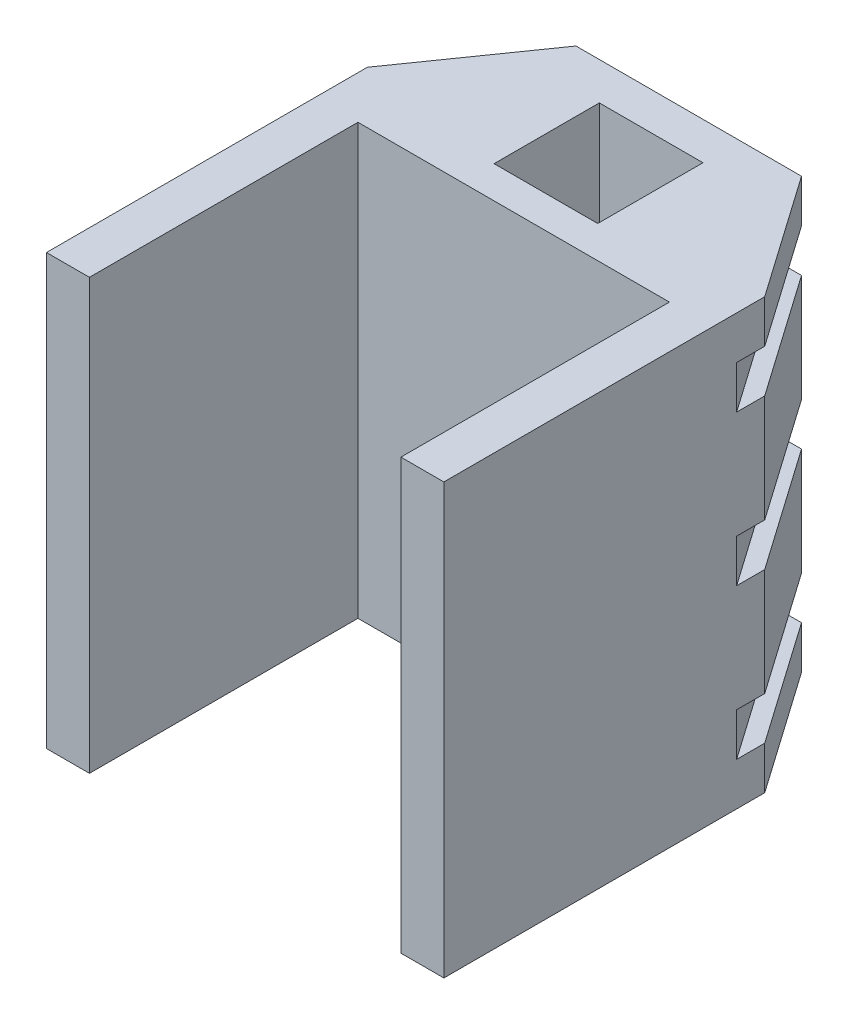
from build123d import *

# Parameters (mm, degrees)
SKETCH2_W              = 4
SKETCH2_H              = 40
SKETCH2_W_2            = 9.675
SKETCH2_W_3            = 9.65
BOTTOMBASE_DEPTH       = 3.5
EXTRUDE_START          = 3.5
SKETCH2_3_W            = 9.675
SKETCH2_3_H            = 40
SKETCH2_3_W_2          = 4
EXTRUDE_U_DEPTH        = 9.8
TOPFORU_START          = 13.3
SKETCH2_5_W            = 37
SKETCH2_5_H            = 40
TOPFORU_DEPTH          = 3
ANGLEDBOTTOM_SIZE      = 8
ANGLEDBOTTOM_SIZE2     = 11.425184054
SIDESTOHOLDMOTOR_START = 16.3
SKETCH2_4_W            = 4
SKETCH2_4_H            = 40
SIDESTOHOLDMOTOR_DEPTH = 25
SKETCH3_W              = 33.690968993
SKETCH3_H              = 4
ZIPTIEHOLE_DEPTH       = 1.5
SKETCH4_W              = 50.344511624
SKETCH4_H              = 4
ZIPTIEHOLE2_DEPTH      = 1.5


with BuildPart() as part:
    # Sketch2 → BottomBase (new body)
    with BuildSketch(Plane.XY):
        with Locations((-16.5, 0)):
            Rectangle(SKETCH2_W, SKETCH2_H)
        with Locations((-9.6625, 0)):
            Rectangle(SKETCH2_W_2, SKETCH2_H)
        Rectangle(SKETCH2_W_3, SKETCH2_H)
        with Locations((9.6625, 0)):
            Rectangle(SKETCH2_W_2, SKETCH2_H)
        with Locations((16.5, 0)):
            Rectangle(SKETCH2_W, SKETCH2_H)
    extrude(amount=BOTTOMBASE_DEPTH)

    # Sketch2<3> → U (add)
    with BuildSketch(Plane.XY.offset(EXTRUDE_START)):
        with Locations((9.6625, 0)):
            Rectangle(SKETCH2_3_W, SKETCH2_3_H)
        with Locations((16.5, 0)):
            Rectangle(SKETCH2_3_W_2, SKETCH2_3_H)
        with Locations((-9.6625, 0)):
            Rectangle(SKETCH2_3_W, SKETCH2_3_H)
        with Locations((-16.5, 0)):
            Rectangle(SKETCH2_3_W_2, SKETCH2_3_H)
    extrude(amount=EXTRUDE_U_DEPTH)

    # Sketch2<5> → topForU (add)
    with BuildSketch(Plane.XY.offset(TOPFORU_START)):
        Rectangle(SKETCH2_5_W, SKETCH2_5_H)
    extrude(amount=TOPFORU_DEPTH)

    # angledBottom
    angledbottom_edges = [part.edges().sort_by_distance(p)[0] for p in [
        (18.5, 0, 0),
        (-18.5, 0, 0),
    ]]
    angledbottom_side = [part.faces().sort_by_distance(p)[0] for p in [
        (0, 0, 0),
    ]]
    chamfer(angledbottom_edges, length=ANGLEDBOTTOM_SIZE, length2=ANGLEDBOTTOM_SIZE2, reference=angledbottom_side[0])

    # Sketch2<4> → sidesToHoldMotor (add)
    with BuildSketch(Plane.XY.offset(SIDESTOHOLDMOTOR_START)):
        with Locations((-16.5, 0)):
            Rectangle(SKETCH2_4_W, SKETCH2_4_H)
        with Locations((16.5, 0)):
            Rectangle(SKETCH2_4_W, SKETCH2_4_H)
    extrude(amount=SIDESTOHOLDMOTOR_DEPTH)

    # Sketch3 → zipTieHole (cut)
    with BuildSketch(Plane(origin=(7.045605752, 0, -4.933386259), x_dir=(-0.5735764363510474, 0, -0.819152044288991), z_dir=(0.819152044288991, 0, -0.5735764363510474))):
        with Locations((-9.106215993, 0)):
            Rectangle(SKETCH3_W, SKETCH3_H)
        with Locations((-9.106215993, 14)):
            Rectangle(SKETCH3_W, SKETCH3_H)
        with Locations((-9.106215993, -14)):
            Rectangle(SKETCH3_W, SKETCH3_H)
    extrude(amount=-ZIPTIEHOLE_DEPTH, mode=Mode.SUBTRACT)

    # Sketch4 → zipTieHole2 (cut)
    with BuildSketch(Plane(origin=(-7.045605752, 0, -4.933386259), x_dir=(-0.5735764363510474, 0, 0.819152044288991), z_dir=(-0.819152044288991, 0, -0.5735764363510474))):
        Rectangle(SKETCH4_W, SKETCH4_H)
        with Locations((0, 14)):
            Rectangle(SKETCH4_W, SKETCH4_H)
        with Locations((0, -14)):
            Rectangle(SKETCH4_W, SKETCH4_H)
    extrude(amount=-ZIPTIEHOLE2_DEPTH, mode=Mode.SUBTRACT)


solid = part.part
